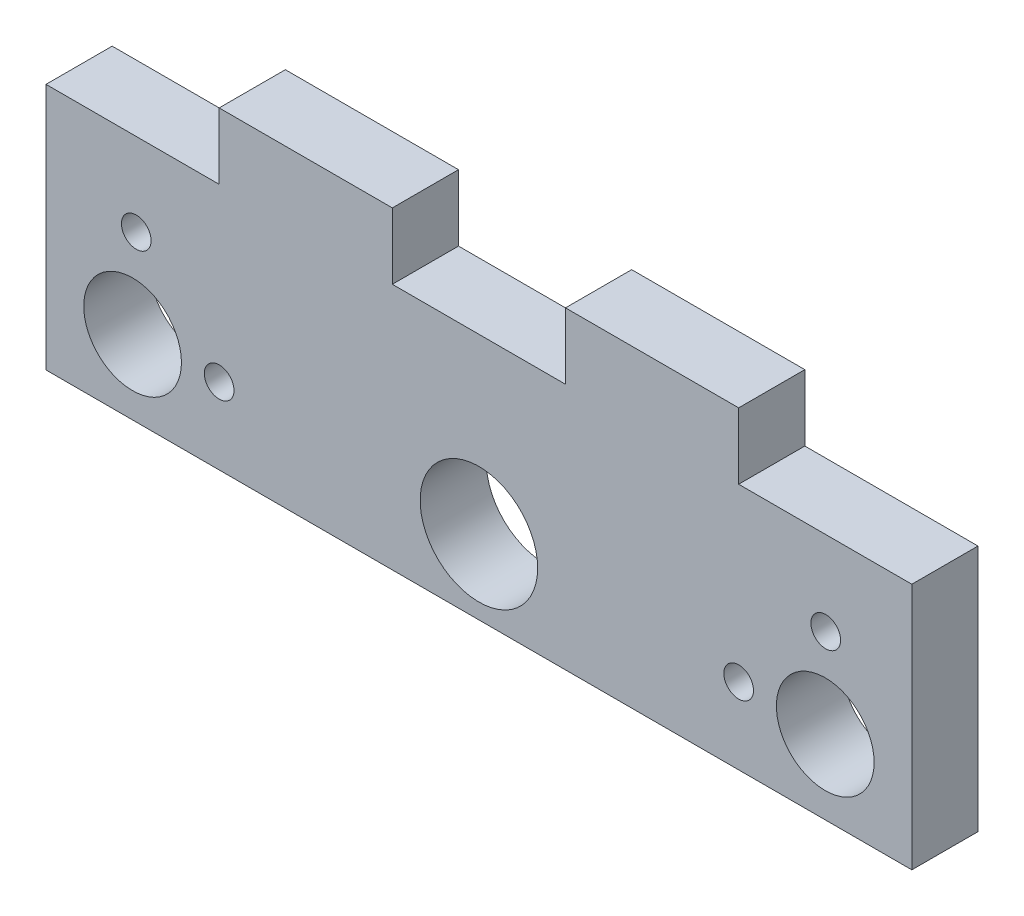
from build123d import *

# Parameters (mm, degrees)
MODEL_R             = 4.75
MODEL_R_2           = 3.95
MODEL_R_3           = 1.2
BOSS_EXTRUDE1_DEPTH = 5.35


with BuildPart() as part:
    # Model → Boss-Extrude1 (new body)
    with BuildSketch(Plane.XY):
        Polygon((0, 19.999999553), (0, 0), (70.000000298, 0), (70.000000298, 19.999999553), (56.000001729, 19.999999553), (56.000001729, 25.349999778), (41.999999434, 25.349999778), (41.999999434, 19.999999553), (28.000000864, 19.999999553), (28.000000864, 25.349999778), (14.000000432, 25.349999778), (14.000000432, 19.999999553), align=None)
        with Locations((35, 5.999999553)):
            Circle(MODEL_R, mode=Mode.SUBTRACT)
        with Locations((63, 5.999999553)):
            Circle(MODEL_R_2, mode=Mode.SUBTRACT)
        with Locations((7, 5.999999553)):
            Circle(MODEL_R_2, mode=Mode.SUBTRACT)
        with Locations((14, 6.159999553)):
            Circle(MODEL_R_3, mode=Mode.SUBTRACT)
        with Locations((56, 6.159999553)):
            Circle(MODEL_R_3, mode=Mode.SUBTRACT)
        with Locations((63.04, 13.199999553)):
            Circle(MODEL_R_3, mode=Mode.SUBTRACT)
        with Locations((7.29808245, 13.299999553)):
            Circle(MODEL_R_3, mode=Mode.SUBTRACT)
    extrude(amount=BOSS_EXTRUDE1_DEPTH)


solid = part.part
